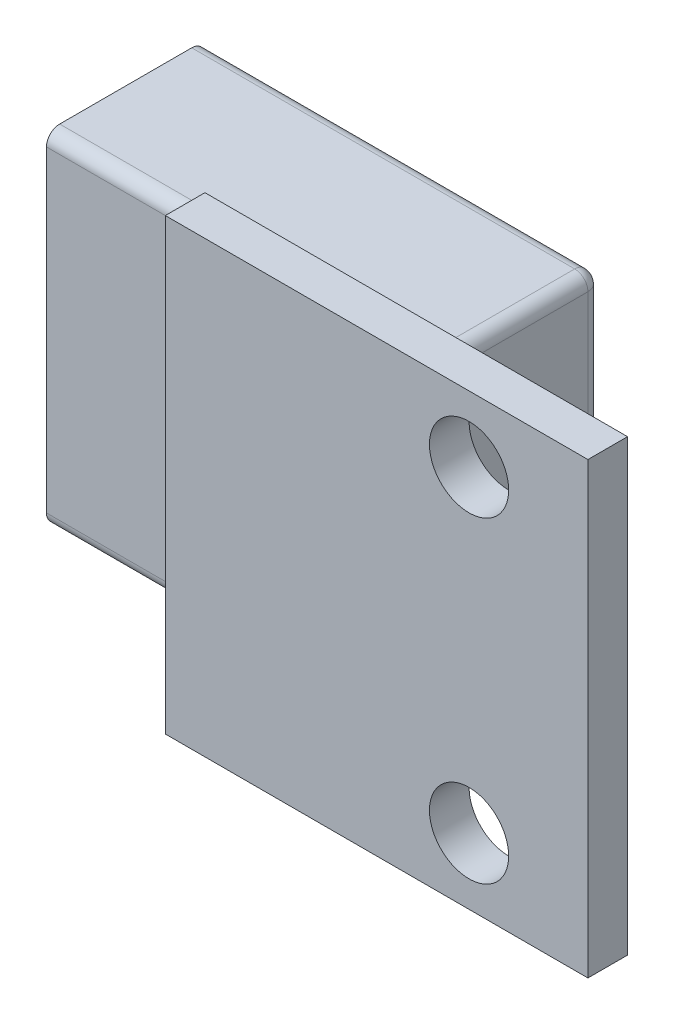
from build123d import *

# Parameters (mm, degrees)
SKETCH1_W           = 16
SKETCH1_H           = 17
BOSS_EXTRUDE1_DEPTH = 1.5
BOSS_EXTRUDE2_DEPTH = 6.5
SKETCH3_W           = 5.4
SKETCH3_H           = 12.4
SKETCH3_W_2         = 2
SKETCH3_H_2         = 10
CUT_EXTRUDE1_DEPTH  = 10
FILLET1_R           = 0.5
FILLET2_R           = 0.5
CHAMFER1_SIZE       = 0.2
SKETCH4_R           = 1.5
CUT_EXTRUDE2_DEPTH  = 10


with BuildPart() as part:
    # Sketch1 → Boss-Extrude1 (new body)
    with BuildSketch(Plane.XY):
        Rectangle(SKETCH1_W, SKETCH1_H)
    extrude(amount=BOSS_EXTRUDE1_DEPTH)

    # Sketch2 → Boss-Extrude2 (add, symmetric)
    with BuildSketch(Plane(origin=(0, 0, 0), x_dir=(1, 0, 0), z_dir=(0, 1, 0))):
        Polygon((-5, 0), (-5, 1), (-15, 1), (-15, 7), (0, 7), (0, 0), align=None)
    extrude(amount=BOSS_EXTRUDE2_DEPTH, both=True)

    # Sketch3 → Cut-Extrude1 (cut)
    with BuildSketch(Plane.ZY.offset(15)):
        with Locations((-4, 0)):
            Rectangle(SKETCH3_W, SKETCH3_H)
        with Locations((-5, 0)):
            Rectangle(SKETCH3_W_2, SKETCH3_H_2, mode=Mode.SUBTRACT)
    extrude(amount=-CUT_EXTRUDE1_DEPTH, mode=Mode.SUBTRACT)

    # Fillet1
    fillet1_edges = [part.edges().sort_by_distance(p)[0] for p in [
        (-7.5, -6.5, -7),
        (-10, -6.5, -1),
        (-7.5, 6.5, -7),
        (-10, 6.5, -1),
        (-10, 6.2, -6.7),
        (-10, 6.2, -1.3),
        (-10, -6.2, -1.3),
        (-10, -6.2, -6.7),
    ]]
    fillet(fillet1_edges, radius=FILLET1_R)

    # Fillet2
    fillet2_edges = [part.edges().sort_by_distance(p)[0] for p in [
        (0, -6.5, -3.25),
        (0, 6.5, -3.25),
        (0, 0, -7),
        (0, 6.353553391, -6.853553391),
        (0, -6.353553391, -6.853553391),
    ]]
    fillet(fillet2_edges, radius=FILLET2_R)

    # Chamfer1
    chamfer1_edges = [part.edges().sort_by_distance(p)[0] for p in [
        (-15, 0, -4),
        (-10, -5, -4),
        (-15, -5, -5),
        (-10, -5, -6),
        (-15, 0, -6),
        (-10, 5, -6),
        (-15, 5, -5),
        (-10, 5, -4),
    ]]
    chamfer(chamfer1_edges, length=CHAMFER1_SIZE)

    # Sketch4 → Cut-Extrude2 (cut)
    with BuildSketch(Plane(origin=(0, 0, 0), x_dir=(-1, 0, 0), z_dir=(0, 0, -1))):
        with Locations((-3.5, 6)):
            Circle(SKETCH4_R)
        with Locations((-3.5, -6)):
            Circle(SKETCH4_R)
    extrude(amount=-CUT_EXTRUDE2_DEPTH, mode=Mode.SUBTRACT)


solid = part.part
